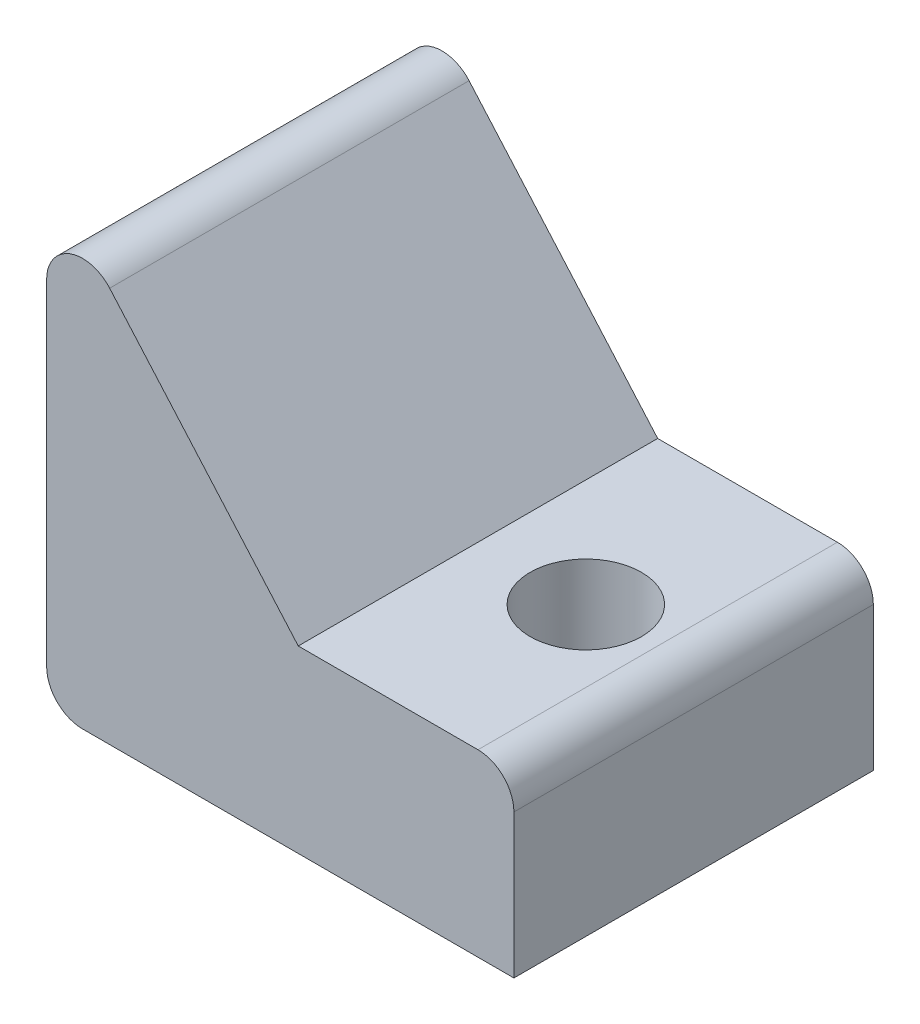
from build123d import *

# Parameters (mm, degrees)
BOSS_EXTRUDE1_DEPTH = 5
SKETCH2_R           = 1.55
CUT_EXTRUDE1_DEPTH  = 10


with BuildPart() as part:
    # Sketch1 → Boss-Extrude1 (new, symmetric)
    with BuildSketch(Plane.XY):
        with BuildLine():
            Line((1, 0), (13, 0))
            Line((13, 0), (13, 4))
            ThreePointArc((13, 4), (12.707106781, 4.707106781), (12, 5))
            Line((12, 5), (7, 5))
            Line((7, 5), (1.752576695, 10.997055206))
            ThreePointArc((1.752576695, 10.997055206), (0.648273327, 11.274653342), (0, 10.338550598))
            Line((0, 10.338550598), (0, 1))
            ThreePointArc((0, 1), (0.292893219, 0.292893219), (1, 0))
        make_face()
    extrude(amount=BOSS_EXTRUDE1_DEPTH, both=True)

    # Sketch2 → Cut-Extrude1 (cut)
    with BuildSketch(Plane.XZ):
        with Locations(Location((10, 0, 0), (0, 0, 270))):
            Circle(SKETCH2_R)
    extrude(amount=-CUT_EXTRUDE1_DEPTH, mode=Mode.SUBTRACT)


solid = part.part
